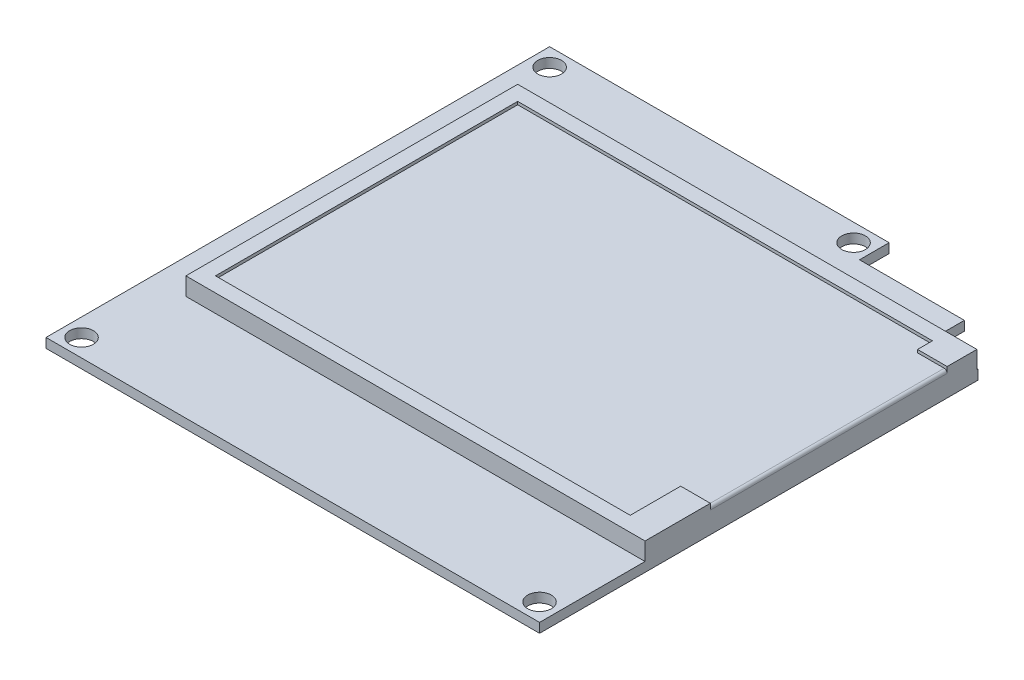
from build123d import *

# Parameters (mm, degrees)
BOSS_EXTRU_1_DEPTH      = 1.6
ESQUISSE5_R             = 2
ENL_V_MAT_EXTRU_1_DEPTH = 1.6
ECRAN_W                 = 77.498087901
ECRAN_H                 = 56.00411385
BOSS_EXTRU_2_DEPTH      = 3
ECRAN_NOIR_W            = 70.00084158
ECRAN_NOIR_H            = 51.004481936
ENL_V_MAT_EXTRU_2_DEPTH = 0.5
NAPPE_CONTACTEURS_W     = 5.000690241
NAPPE_CONTACTEURS_H     = 39.972572183
ENL_V_MAT_EXTRU_3_DEPTH = 0.5
CONG_1_R                = 0.5


with BuildPart() as part:
    # Esquisse1 → Boss.-Extru.1 (new body)
    with BuildSketch(Plane(origin=(0, 0, 0), x_dir=(1, 0, 0), z_dir=(0, 1, 0))):
        Polygon((0, 0), (83.3, 0), (83.3, 74), (75, 74), (75, 80), (57.3, 80), (57.3, 85), (0, 85), align=None)
    extrude(amount=BOSS_EXTRU_1_DEPTH)

    # Esquisse5 → Enlèv. mat.-Extru.1 (cut)
    with BuildSketch(Plane(origin=(0, 1.6, 0), x_dir=(1, 0, 0), z_dir=(0, 1, 0))):
        with Locations(Location((54.3, 82, 0), (0, 0, 270))):
            Circle(ESQUISSE5_R)
        with Locations(Location((3, 82, 0), (0, 0, 270))):
            Circle(ESQUISSE5_R)
        with Locations(Location((3, 2.996959755, 0), (0, 0, 270))):
            Circle(ESQUISSE5_R)
        with Locations(Location((80.298286248, 2.996959755, 0), (0, 0, 270))):
            Circle(ESQUISSE5_R)
    extrude(amount=-ENL_V_MAT_EXTRU_1_DEPTH, mode=Mode.SUBTRACT)

    # ecran → Boss.-Extru.2 (add)
    with BuildSketch(Plane(origin=(0, 1.6, 0), x_dir=(1, 0, 0), z_dir=(0, 1, 0))):
        with Locations((44.55095605, 45.806316508)):
            Rectangle(ECRAN_W, ECRAN_H)
    extrude(amount=BOSS_EXTRU_2_DEPTH)

    # ecran noir → Enlèv. mat.-Extru.2 (cut)
    with BuildSketch(Plane(origin=(0, 4.6, 0), x_dir=(1, 0, 0), z_dir=(0, 1, 0))):
        with Locations((43.298888969, 45.808865656)):
            Rectangle(ECRAN_NOIR_W, ECRAN_NOIR_H)
    extrude(amount=-ENL_V_MAT_EXTRU_2_DEPTH, mode=Mode.SUBTRACT)

    # nappe contacteurs → Enlèv. mat.-Extru.3 (cut)
    with BuildSketch(Plane(origin=(0, 4.6, 0), x_dir=(1, 0, 0), z_dir=(0, 1, 0))):
        with Locations((80.79965488, 48.80952599)):
            Rectangle(NAPPE_CONTACTEURS_W, NAPPE_CONTACTEURS_H)
    extrude(amount=-ENL_V_MAT_EXTRU_3_DEPTH, mode=Mode.SUBTRACT)

    # Congé1
    cong_1_edges = [part.edges().sort_by_distance(p)[0] for p in [
        (83.3, 4.1, -48.809525991),
    ]]
    fillet(cong_1_edges, radius=CONG_1_R)


solid = part.part
